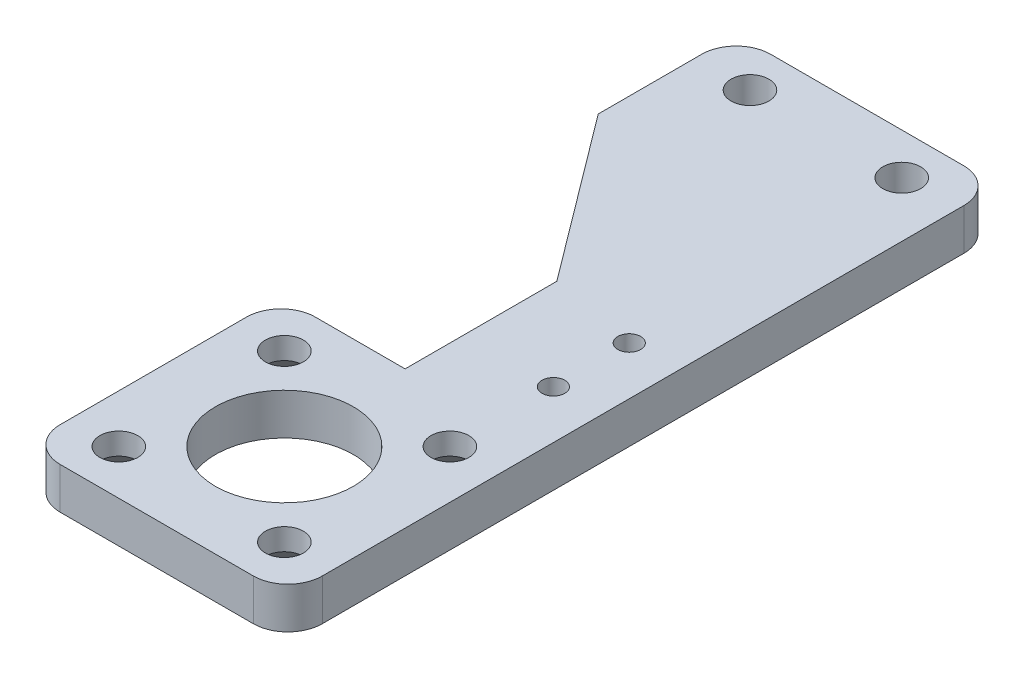
from build123d import *

# Parameters (mm, degrees)
SKETCH_1_W                   = 38
SKETCH_1_H                   = 103
EXTRUDE_1_DEPTH              = 3
CUT_EXTRUDE_1_DEPTH          = 56.220014488
SKETCH_3_R                   = 10
CUT_EXTRUDE_2_DEPTH          = 56.220014488
HOLE_WIZARD_M5_1_D           = 5.5
HOLE_WIZARD_M5_1_CSINK_D     = 11.2
HOLE_WIZARD_M5_1_CSINK_ANGLE = 90
M4X0_7_1_D                   = 3.3
M4X0_7_1_DEPTH               = 10.1
M4X0_7_1_TIP                 = 0.991420021
SKETCH_8_R                   = 2.75
CUT_EXTRUDE_3_DEPTH          = 56.220014488
FILLET_1_R                   = 5


with BuildPart() as part:
    # 草图1 → 凸台-拉伸1 (new, symmetric)
    with BuildSketch(Plane(origin=(0, 0, 0), x_dir=(1, 0, 0), z_dir=(0, 1, 0))):
        Rectangle(SKETCH_1_W, SKETCH_1_H)
    extrude(amount=EXTRUDE_1_DEPTH, both=True)

    # 草图2 → 切除-拉伸1 (cut, through all)
    with BuildSketch(Plane(origin=(0, 3, 0), x_dir=(1, 0, 0), z_dir=(0, 1, 0))):
        Polygon((-19, -14.5), (-1, -14.5), (-1, 7.5), (-19, 31.5), align=None)
    extrude(amount=-CUT_EXTRUDE_1_DEPTH, mode=Mode.SUBTRACT)

    # 草图3 → 切除-拉伸2 (cut, through all)
    with BuildSketch(Plane(origin=(0, 3, 0), x_dir=(1, 0, 0), z_dir=(0, 1, 0))):
        with Locations(Location((0, -33, 0), (0, 0, 270))):
            Circle(SKETCH_3_R)
    extrude(amount=-CUT_EXTRUDE_2_DEPTH, mode=Mode.SUBTRACT)

    # M5 六角凹锥坑螺钉的锥形沉头孔1 (through all)
    with Locations(Plane.XZ.offset(3)):
        with Locations((12, 45), (-12, 45), (-12, 21), (12, 21)):
            CounterSinkHole(HOLE_WIZARD_M5_1_D / 2, HOLE_WIZARD_M5_1_CSINK_D / 2, counter_sink_angle=HOLE_WIZARD_M5_1_CSINK_ANGLE)

    # M4x0.7 螺纹孔1
    with Locations(Plane(origin=(0, 3, 0), x_dir=(-1, 0, 0), z_dir=(0, 1, 0))):
        with Locations((-12, -5), (-12, 6)):
            Hole(M4X0_7_1_D / 2, depth=M4X0_7_1_DEPTH)
            with Locations((0, 0, -(M4X0_7_1_DEPTH + M4X0_7_1_TIP / 2))):  # 118° drill point
                Cone(0, M4X0_7_1_D / 2, M4X0_7_1_TIP, mode=Mode.SUBTRACT)

    # 草图8 → 切除-拉伸3 (cut, through all)
    with BuildSketch(Plane(origin=(0, 3, 0), x_dir=(1, 0, 0), z_dir=(0, 1, 0))):
        with Locations(Location((-11, 45.5, 0), (0, 0, 270))):
            Circle(SKETCH_8_R)
        with Locations(Location((11, 45.5, 0), (0, 0, 270))):
            Circle(SKETCH_8_R)
    extrude(amount=-CUT_EXTRUDE_3_DEPTH, mode=Mode.SUBTRACT)

    # 圆角1
    fillet_1_edges = [part.edges().sort_by_distance(p)[0] for p in [
        (-19, 0, 14.5),
        (-19, 0, -51.5),
        (19, 0, -51.5),
        (19, 0, 51.5),
        (-19, 0, 51.5),
    ]]
    fillet(fillet_1_edges, radius=FILLET_1_R)


solid = part.part
